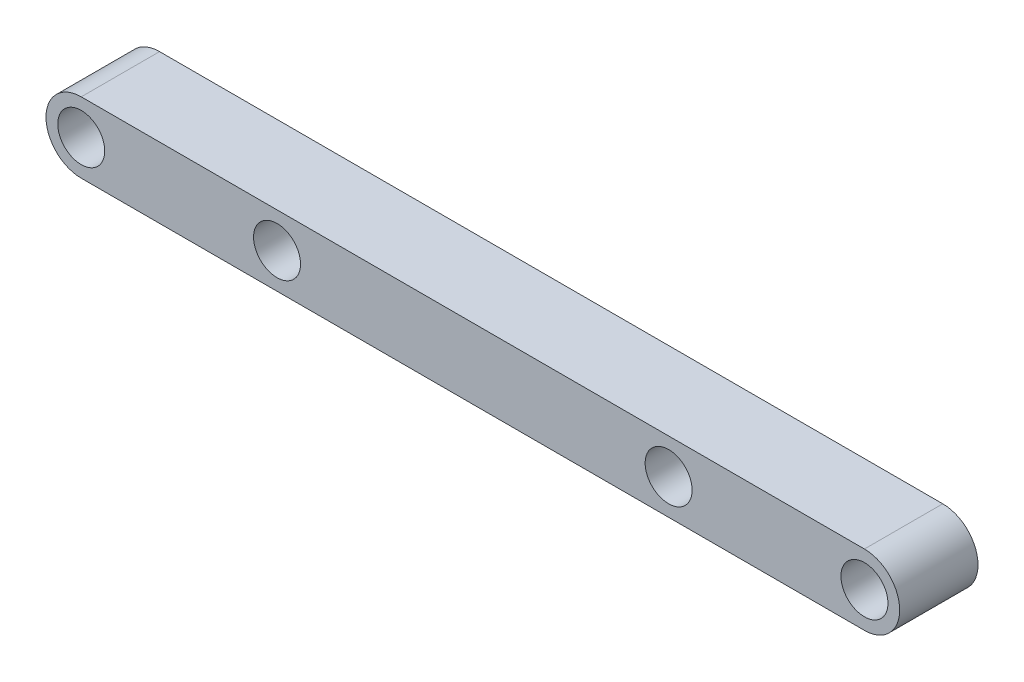
from build123d import *

# Parameters (mm, degrees)
SKETCH1_R           = 3
BOSS_EXTRUDE1_DEPTH = 10


with BuildPart() as part:
    # Sketch1 → Boss-Extrude1 (new body)
    with BuildSketch(Plane.XY):
        with BuildLine():
            Line((-6.241050119, 5.836515513), (93.758949881, 5.836515513))
            ThreePointArc((93.758949881, 5.836515513), (98.258949881, 1.336515513), (93.758949881, -3.163484487))
            Line((93.758949881, -3.163484487), (-6.241050119, -3.163484487))
            ThreePointArc((-6.241050119, -3.163484487), (-10.741050119, 1.336515513), (-6.241050119, 5.836515513))
        make_face()
        with Locations((-6.241050119, 1.336515513)):
            Circle(SKETCH1_R, mode=Mode.SUBTRACT)
        with Locations((68.758949881, 1.336515513)):
            Circle(SKETCH1_R, mode=Mode.SUBTRACT)
        with Locations((93.758949881, 1.336515513)):
            Circle(SKETCH1_R, mode=Mode.SUBTRACT)
        with Locations((18.758949881, 1.336515513)):
            Circle(SKETCH1_R, mode=Mode.SUBTRACT)
    extrude(amount=BOSS_EXTRUDE1_DEPTH)


solid = part.part
